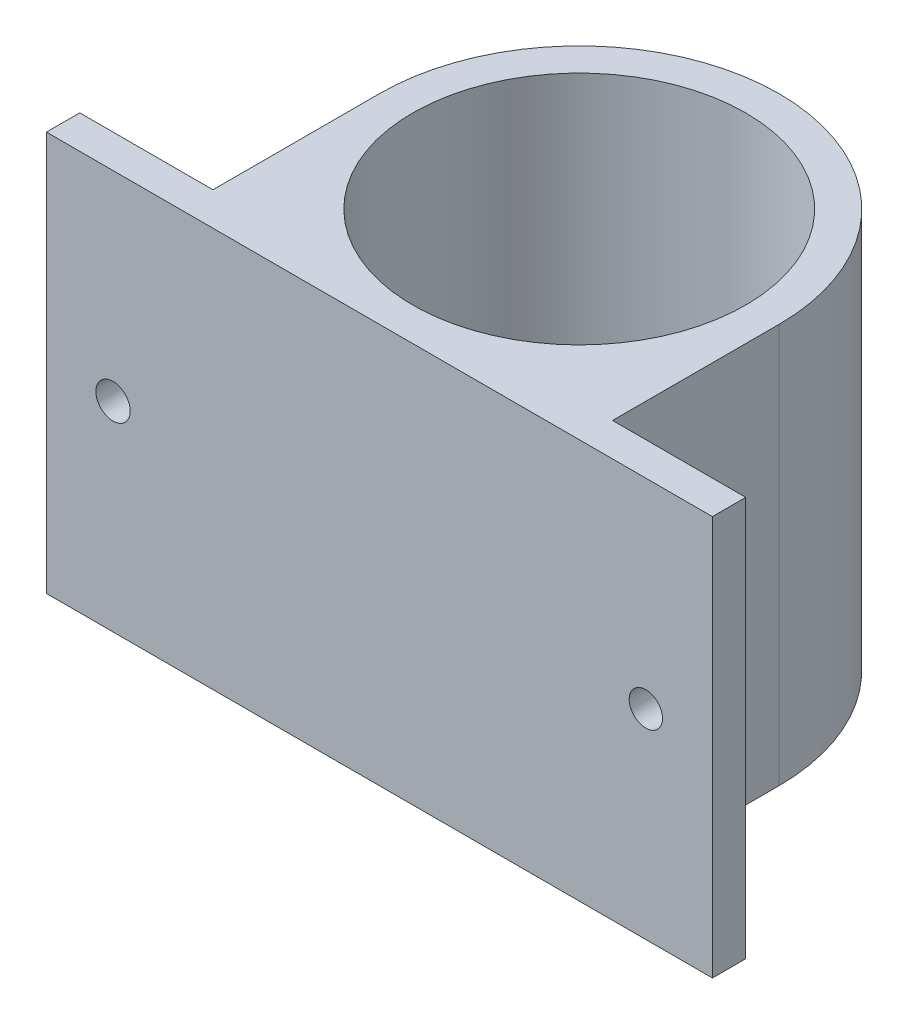
from build123d import *

# Parameters (mm, degrees)
SKETCH1_R           = 31.75
BOSS_EXTRUDE1_DEPTH = 76.2
SKETCH2_R           = 3.2766
SKETCH2_R_2         = 3.175
CUT_EXTRUDE1_DEPTH  = 50.8


with BuildPart() as part:
    # Sketch1 → Boss-Extrude1 (new body)
    with BuildSketch(Plane(origin=(0, 0, 0), x_dir=(1, 0, 0), z_dir=(0, 1, 0))):
        with BuildLine():
            Line((-38.1, -31.75), (-63.5, -31.75))
            Line((-63.5, -31.75), (-63.5, -38.1))
            Line((-63.5, -38.1), (63.5, -38.1))
            Line((63.5, -38.1), (63.5, -31.75))
            Line((63.5, -31.75), (38.1, -31.75))
            Line((38.1, -31.75), (38.1, 0))
            ThreePointArc((38.1, 0), (0, 38.1), (-38.1, 0))
            Line((-38.1, 0), (-38.1, -31.75))
        make_face()
        with Locations(Location((0, 0, 0), (0, 0, 90))):
            Circle(SKETCH1_R, mode=Mode.SUBTRACT)
    extrude(amount=BOSS_EXTRUDE1_DEPTH)

    # Sketch2 → Cut-Extrude1 (cut)
    with BuildSketch(Plane(origin=(0, 0, 31.75), x_dir=(-1, 0, 0), z_dir=(0, 0, -1))):
        with Locations((50.8, 38.1)):
            Circle(SKETCH2_R)
        with Locations((-50.8, 38.1)):
            Circle(SKETCH2_R_2)
    extrude(amount=-CUT_EXTRUDE1_DEPTH, mode=Mode.SUBTRACT)


solid = part.part
